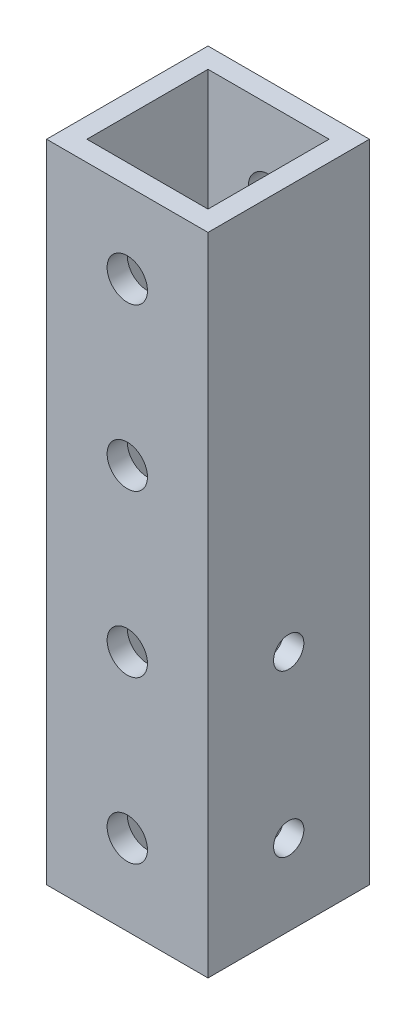
from build123d import *

# Parameters (mm, degrees)
SKETCH1_W           = 25.4
SKETCH1_H           = 101.6
BOSS_EXTRUDE1_DEPTH = 25.4
SHELL1_T            = -3.175
SKETCH2_R           = 3.175
CUT_EXTRUDE1_DEPTH  = 108.763073453
SKETCH3_R           = 2.38125
CUT_EXTRUDE2_DEPTH  = 7.62


with BuildPart() as part:
    # Sketch1 → Boss-Extrude1 (new body)
    with BuildSketch(Plane.XY):
        with Locations((12.7, 50.8)):
            Rectangle(SKETCH1_W, SKETCH1_H)
    extrude(amount=BOSS_EXTRUDE1_DEPTH)

    # Shell1
    shell1_openings = [part.faces().sort_by_distance(p)[0] for p in [
        (12.7, 101.6, 12.7),
        (12.7, 0, 12.7),
    ]]
    offset(amount=SHELL1_T, openings=shell1_openings, kind=Kind.INTERSECTION)

    # Sketch2 → Cut-Extrude1 (cut, through all)
    with BuildSketch(Plane.XY.offset(25.4)):
        with Locations((12.7, 12.7)):
            Circle(SKETCH2_R)
        with Locations((12.7, 38.1)):
            Circle(SKETCH2_R)
        with Locations((12.7, 88.9)):
            Circle(SKETCH2_R)
        with Locations((12.7, 63.5)):
            Circle(SKETCH2_R)
    extrude(amount=-CUT_EXTRUDE1_DEPTH, mode=Mode.SUBTRACT)

    # Sketch3 → Cut-Extrude2 (cut)
    with BuildSketch(Plane(origin=(25.4, 0, 0), x_dir=(0, 0, -1), z_dir=(1, 0, 0))):
        with Locations((-12.7, 12.7)):
            Circle(SKETCH3_R)
        with Locations((-12.7, 38.1)):
            Circle(SKETCH3_R)
    extrude(amount=-CUT_EXTRUDE2_DEPTH, mode=Mode.SUBTRACT)


solid = part.part
